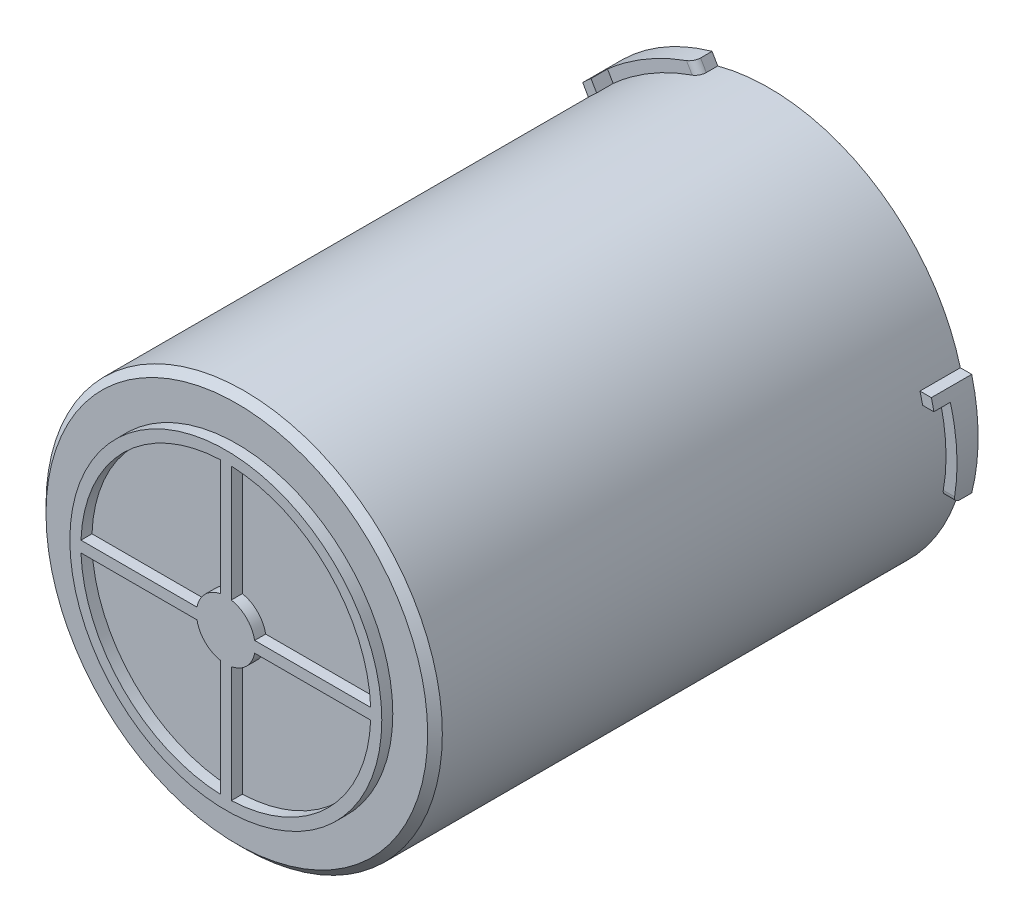
from build123d import *

# Parameters (mm, degrees)
EXTRUDE_1_DEPTH                  = 10
FILLET_1_R                       = 2
PATTERN_CIRCULAR_2_COUNT         = 3
FILLET_1_OF_PATTERN_CIRCULAR_2_R = 2
CUT_EXTRUDE_START                = -15
SKETCH_3_R                       = 51
CUT_EXTRUDE_1_DEPTH              = 15
SKETCH_4_R                       = 62.618720145
SKETCH_4_R_2                     = 57
CUT_EXTRUDE_2_DEPTH              = 15
CHAMFER_1_SIZE                   = 2
FILLET_2_R                       = 5
SKETCH_5_R                       = 42.5
EXTRUDE_2_DEPTH                  = 3
SKETCH_7_R                       = 39.5
CUT_EXTRUDE_3_DEPTH              = 3
EXTRUDE_START                    = 3
SKETCH_8_W                       = 3
SKETCH_8_H                       = 3
EXTRUDE_4_DEPTH                  = 3


with BuildPart() as part:
    # Эскиз1 → Повернуть1 (revolve)
    with BuildSketch(Plane(origin=(0, 0, 0), x_dir=(1, 0, 0), z_dir=(0, 1, 0))):
        Polygon((0, 0), (-54, 0), (-54, 145), (-51, 145), (-51, 3), (0, 3), align=None)
    revolve(axis=Axis((0, 0, -3), (0, 0, 1)))

    # Эскиз2 → Бобышка-Вытянуть1 (add)
    with BuildSketch(Plane(origin=(57, 0, 0), x_dir=(0, 0, -1), z_dir=(1, 0, 0))):
        Polygon((145, 14), (145, -14), (140, -14), (138.5, 11), (134, 11), (134, 14), align=None)
    extrude_1 = extrude(amount=-EXTRUDE_1_DEPTH)

    # Скругление1
    fillet_1_edges = [part.edges().sort_by_distance(p)[0] for p in [
        (54.576809621, -14, -140),
    ]]
    fillet(fillet_1_edges, radius=FILLET_1_R)

    # Круговой массив2: Бобышка-Вытянуть1 ×3 about axis
    pattern_circular_2_axis = Axis((0, 0, 0), (0, 0, 1))
    for i in range(1, PATTERN_CIRCULAR_2_COUNT):
        add(extrude_1.rotate(pattern_circular_2_axis, i * 360 / PATTERN_CIRCULAR_2_COUNT))

    # Скругление1 of Круговой массив2
    fillet_1_of_pattern_circular_2_edges = [part.edges().sort_by_distance(p)[0] for p in [
        (-15.164049157, 54.264903589, -140),
        (-39.412760463, -40.264903589, -140),
    ]]
    fillet(fillet_1_of_pattern_circular_2_edges, radius=FILLET_1_OF_PATTERN_CIRCULAR_2_R)

    # Эскиз3 → Вырез-Вытянуть1 (cut)
    with BuildSketch(Plane(origin=(0, 0, -145), x_dir=(-1, 0, 0), z_dir=(0, 0, -1)).offset(CUT_EXTRUDE_START)):
        Circle(SKETCH_3_R)
    extrude(amount=CUT_EXTRUDE_1_DEPTH, mode=Mode.SUBTRACT)

    # Эскиз4 → Вырез-Вытянуть2 (cut)
    with BuildSketch(Plane(origin=(0, 0, -145), x_dir=(-1, 0, 0), z_dir=(0, 0, -1))):
        Circle(SKETCH_4_R)
        Circle(SKETCH_4_R_2, mode=Mode.SUBTRACT)
    extrude(amount=-CUT_EXTRUDE_2_DEPTH, mode=Mode.SUBTRACT)

    # Фаска1
    chamfer_1_edges = [part.edges().sort_by_distance(p)[0] for p in [
        (54, 0, 0),
    ]]
    chamfer(chamfer_1_edges, length=CHAMFER_1_SIZE)

    # Скругление2
    fillet_2_edges = [part.edges().sort_by_distance(p)[0] for p in [
        (51, 0, -3),
    ]]
    fillet(fillet_2_edges, radius=FILLET_2_R)

    # Эскиз5 → Бобышка-Вытянуть2 (add)
    with BuildSketch(Plane.XY):
        Circle(SKETCH_5_R)
    extrude(amount=EXTRUDE_2_DEPTH)

    # Эскиз7 → Вырез-Вытянуть3 (cut)
    with BuildSketch(Plane.XY.offset(3)):
        Circle(SKETCH_7_R)
    extrude(amount=-CUT_EXTRUDE_3_DEPTH, mode=Mode.SUBTRACT)

    # Эскиз8 → Бобышка-Вытянуть4 (add)
    with BuildSketch(Plane.XY.offset(EXTRUDE_START)):
        with BuildLine():
            Line((-1.5, -7.858116823), (-1.5, -39.471508712))
            ThreePointArc((-1.5, -39.471508712), (0, -39.5), (1.5, -39.471508712))
            Line((1.5, -39.471508712), (1.5, -7.858116823))
            ThreePointArc((1.5, -7.858116823), (0, -8), (-1.5, -7.858116823))
        make_face()
        with BuildLine():
            ThreePointArc((1.5, 39.471508712), (0, 39.5), (-1.5, 39.471508712))
            Line((-1.5, 39.471508712), (-1.5, 7.858116823))
            ThreePointArc((-1.5, 7.858116823), (0, 8), (1.5, 7.858116823))
            Line((1.5, 7.858116823), (1.5, 39.471508712))
        make_face()
        with BuildLine():
            Line((-1.5, 7.858116823), (-1.5, 1.5))
            Line((-1.5, 1.5), (1.5, 1.5))
            Line((1.5, 1.5), (1.5, 7.858116823))
            ThreePointArc((1.5, 7.858116823), (0, 8), (-1.5, 7.858116823))
        make_face()
        with BuildLine():
            Line((1.5, 7.858116823), (1.5, 1.5))
            Line((1.5, 1.5), (7.858116823, 1.5))
            ThreePointArc((7.858116823, 1.5), (5.656854249, 5.656854249), (1.5, 7.858116823))
        make_face()
        with BuildLine():
            Line((1.5, 1.5), (1.5, -1.5))
            Line((1.5, -1.5), (7.858116823, -1.5))
            ThreePointArc((7.858116823, -1.5), (7.964450219, -0.753347668), (8, 0))
            ThreePointArc((8, 0), (7.964450219, 0.753347668), (7.858116823, 1.5))
            Line((7.858116823, 1.5), (1.5, 1.5))
        make_face()
        with BuildLine():
            ThreePointArc((-39.471508712, 1.5), (-39.5, 0), (-39.471508712, -1.5))
            Line((-39.471508712, -1.5), (-7.858116823, -1.5))
            ThreePointArc((-7.858116823, -1.5), (-8, 0), (-7.858116823, 1.5))
            Line((-7.858116823, 1.5), (-39.471508712, 1.5))
        make_face()
        with BuildLine():
            Line((7.858116823, -1.5), (39.471508712, -1.5))
            ThreePointArc((39.471508712, -1.5), (39.492876536, -0.75013528), (39.5, 0))
            ThreePointArc((39.5, 0), (39.492876536, 0.75013528), (39.471508712, 1.5))
            Line((39.471508712, 1.5), (7.858116823, 1.5))
            ThreePointArc((7.858116823, 1.5), (7.964450219, 0.753347668), (8, 0))
            ThreePointArc((8, 0), (7.964450219, -0.753347668), (7.858116823, -1.5))
        make_face()
        with BuildLine():
            Line((1.5, -1.5), (1.5, -7.858116823))
            ThreePointArc((1.5, -7.858116823), (5.656854249, -5.656854249), (7.858116823, -1.5))
            Line((7.858116823, -1.5), (1.5, -1.5))
        make_face()
        with BuildLine():
            Line((-1.5, -1.5), (-1.5, -7.858116823))
            ThreePointArc((-1.5, -7.858116823), (0, -8), (1.5, -7.858116823))
            Line((1.5, -7.858116823), (1.5, -1.5))
            Line((1.5, -1.5), (-1.5, -1.5))
        make_face()
        Rectangle(SKETCH_8_W, SKETCH_8_H)
        with BuildLine():
            Line((-7.858116823, 1.5), (-1.5, 1.5))
            Line((-1.5, 1.5), (-1.5, 7.858116823))
            ThreePointArc((-1.5, 7.858116823), (-5.656854249, 5.656854249), (-7.858116823, 1.5))
        make_face()
        with BuildLine():
            Line((-7.858116823, -1.5), (-1.5, -1.5))
            Line((-1.5, -1.5), (-1.5, 1.5))
            Line((-1.5, 1.5), (-7.858116823, 1.5))
            ThreePointArc((-7.858116823, 1.5), (-8, 0), (-7.858116823, -1.5))
        make_face()
        with BuildLine():
            ThreePointArc((-7.858116823, -1.5), (-5.656854249, -5.656854249), (-1.5, -7.858116823))
            Line((-1.5, -7.858116823), (-1.5, -1.5))
            Line((-1.5, -1.5), (-7.858116823, -1.5))
        make_face()
    extrude(amount=-EXTRUDE_4_DEPTH)


solid = part.part
